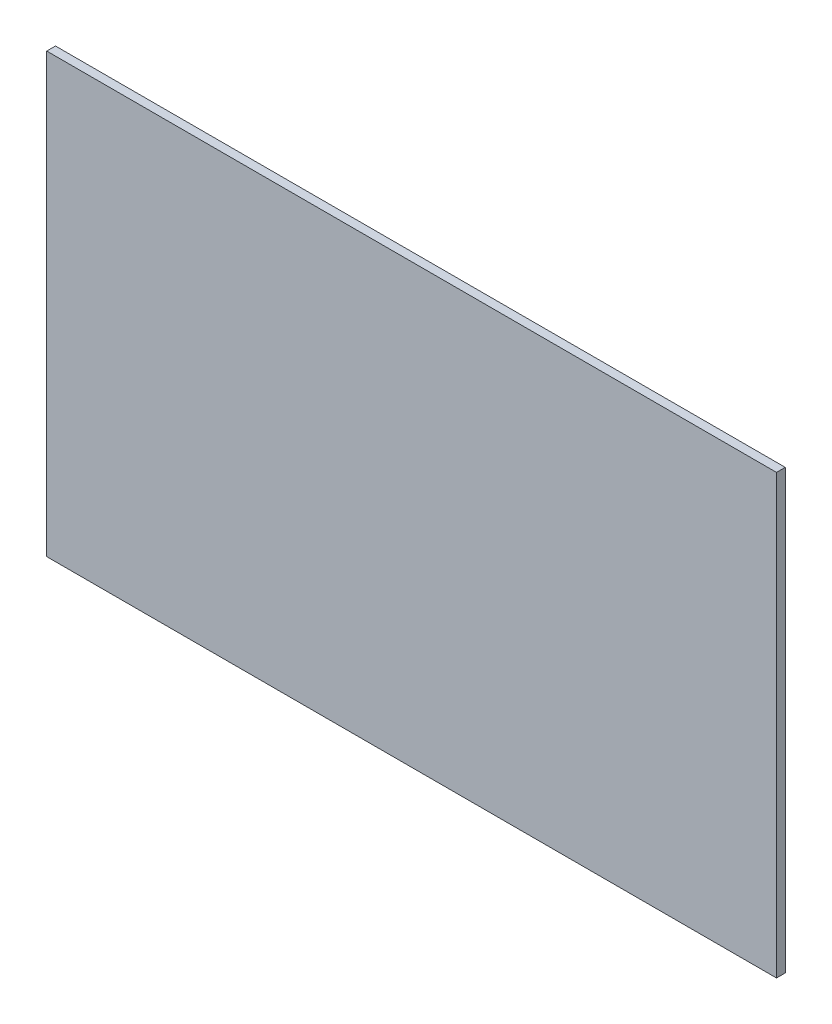
from build123d import *

# Parameters (mm, degrees)
SKETCH_1_W      = 250
SKETCH_1_H      = 150
EXTRUDE_1_DEPTH = 3


with BuildPart() as part:
    # Эскиз1 → Бобышка-Вытянуть1 (new body)
    with BuildSketch(Plane.XY):
        with Locations((19.424131627, -19.698354662)):
            Rectangle(SKETCH_1_W, SKETCH_1_H)
    extrude(amount=EXTRUDE_1_DEPTH)


solid = part.part
